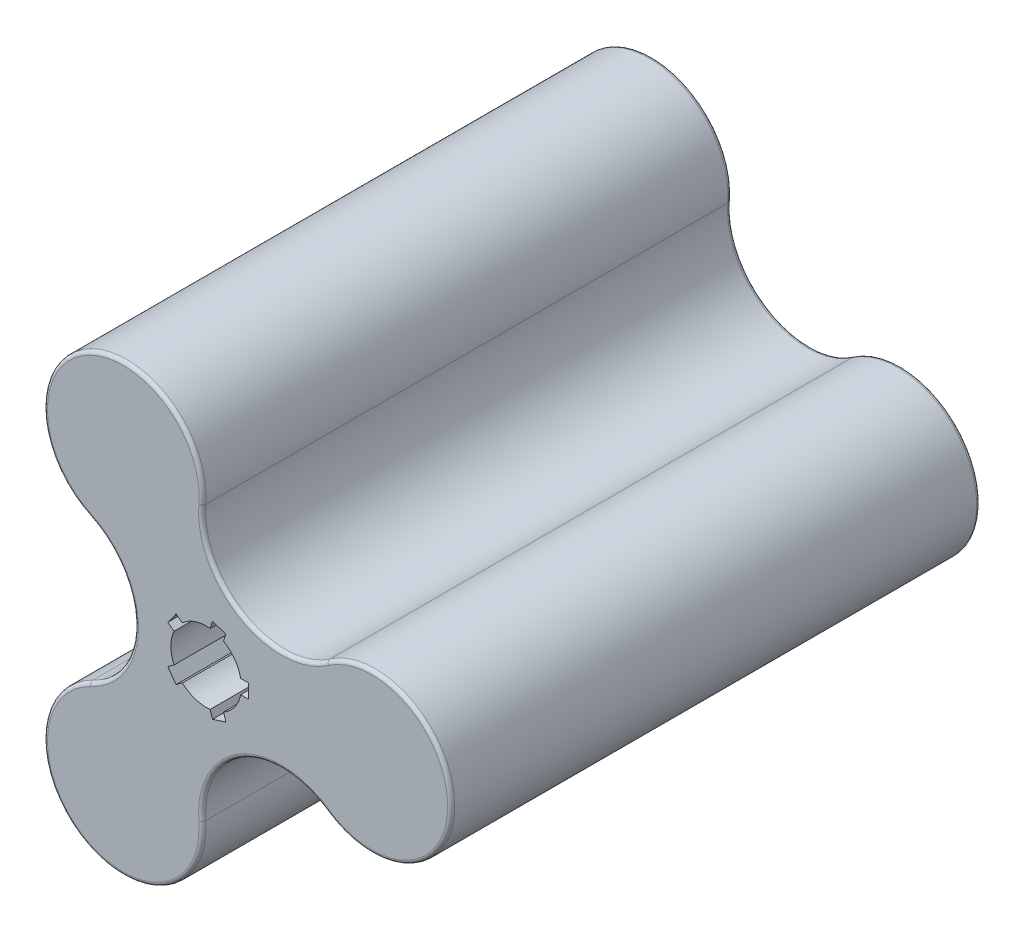
from build123d import *

# Parameters (mm, degrees)
SKETCH1_R           = 22.5
BOSS_EXTRUDE1_DEPTH = 150
FILLET1_R           = 1


with BuildPart() as part:
    # Sketch1 → Boss-Extrude1 (new body)
    # profile 1 of 4: a face of its own
    with BuildSketch(Plane.XY):
        with Locations((47, 0)):
            Circle(SKETCH1_R)
    # profile 2 of 4: a face of its own
    with BuildSketch(Plane.XY):
        with Locations((-23.5, -40.703193978)):
            Circle(SKETCH1_R)
    # profile 3 of 4: a face of its own
    with BuildSketch(Plane.XY):
        with Locations((-23.5, 40.703193978)):
            Circle(SKETCH1_R)
    # profile 4 of 4: a face of its own
    with BuildSketch(Plane.XY):
        with BuildLine():
            ThreePointArc((34.172460266, -18.485243422), (24.5, 0), (34.172460266, 18.485243422))
            ThreePointArc((34.172460266, 18.485243422), (10.094920531, 17.484915258), (-1.077539734, 38.836840411))
            ThreePointArc((-1.077539734, 38.836840411), (-12.25, 21.217622393), (-33.094920531, 20.351596989))
            ThreePointArc((-33.094920531, 20.351596989), (-20.189841062, 0), (-33.094920531, -20.351596989))
            ThreePointArc((-33.094920531, -20.351596989), (-12.25, -21.217622393), (-1.077539734, -38.836840411))
            ThreePointArc((-1.077539734, -38.836840411), (10.094920531, -17.484915258), (34.172460266, -18.485243422))
        make_face()
        with BuildLine():
            Line((1.8060909, -12.030712184), (1.1256228, -9.936446715))
            ThreePointArc((1.1256228, -9.936446715), (-3.090169944, -9.510565163), (-6.751144813, -7.377129775))
            Line((-6.751144813, -7.377129775), (-8.532633428, -8.671457016))
            Line((-8.532633428, -8.671457016), (-10.883774437, -5.435389039))
            Line((-10.883774437, -5.435389039), (-9.102285822, -4.141061797))
            ThreePointArc((-9.102285822, -4.141061797), (-10, 0), (-9.102285822, 4.141061797))
            Line((-9.102285822, 4.141061797), (-10.883774437, 5.435389039))
            Line((-10.883774437, 5.435389039), (-8.532633428, 8.671457016))
            Line((-8.532633428, 8.671457016), (-6.751144813, 7.377129775))
            ThreePointArc((-6.751144813, 7.377129775), (-3.090169944, 9.510565163), (1.1256228, 9.936446715))
            Line((1.1256228, 9.936446715), (1.8060909, 12.030712184))
            Line((1.8060909, 12.030712184), (5.610316965, 10.794644207))
            Line((5.610316965, 10.794644207), (4.929848865, 8.700378737))
            ThreePointArc((4.929848865, 8.700378737), (8.090169944, 5.877852523), (9.797958971, 2))
            Line((9.797958971, 2), (12, 2))
            Line((12, 2), (12, -2))
            Line((12, -2), (9.797958971, -2))
            ThreePointArc((9.797958971, -2), (8.090169944, -5.877852523), (4.929848865, -8.700378737))
            Line((4.929848865, -8.700378737), (5.610316965, -10.794644207))
            Line((5.610316965, -10.794644207), (1.8060909, -12.030712184))
        make_face(mode=Mode.SUBTRACT)
    extrude(amount=BOSS_EXTRUDE1_DEPTH)

    # Fillet1
    fillet1_edges = [part.edges().sort_by_distance(p)[0] for p in [
        (10.094920531, 17.484915258, 150),
        (-34.75, 60.188765563, 150),
        (-20.189841062, 0, 150),
        (-34.75, -60.188765563, 150),
        (10.094920531, -17.484915258, 150),
        (10.094920531, -17.484915258, 0),
        (-34.75, -60.188765563, 0),
        (-20.189841062, 0, 0),
        (-34.75, 60.188765563, 0),
        (10.094920531, 17.484915258, 0),
        (69.5, 0, 0),
        (69.5, 0, 150),
    ]]
    fillet(fillet1_edges, radius=FILLET1_R)


solid = part.part
